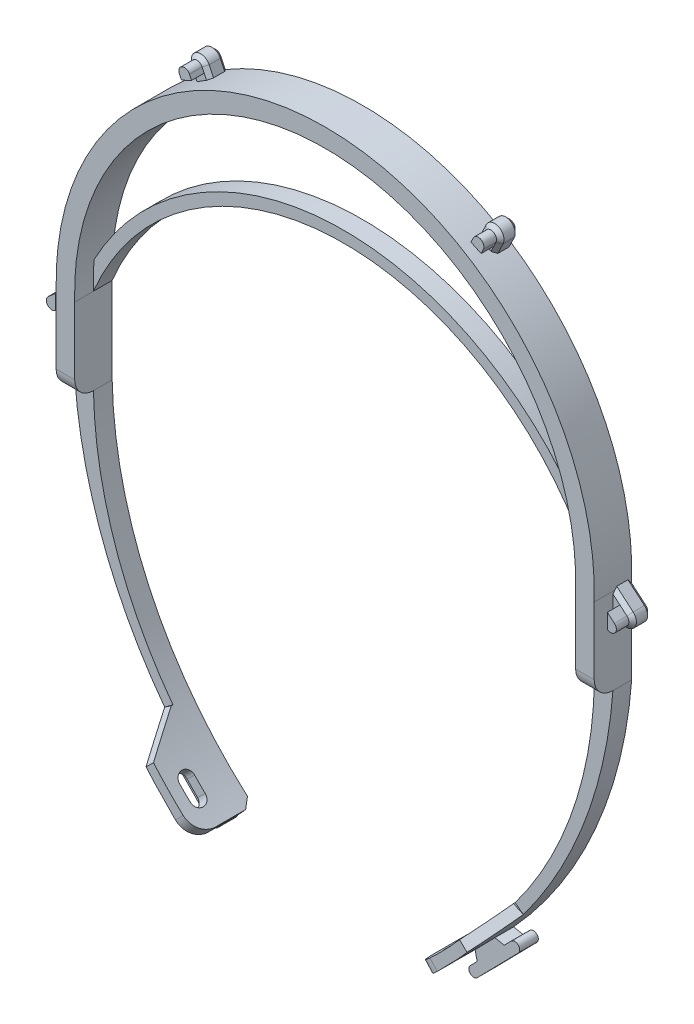
from build123d import *

# Parameters (mm, degrees)
BOSS_EXTRU_1_DEPTH      = 10
BOSS_EXTRU_2_DEPTH      = 5
BOSS_EXTRU_3_DEPTH      = 5
CHANFREIN1_SIZE         = 1
BOSS_EXTRU_4_DEPTH      = 5
BOSS_EXTRU_4_2_DEPTH    = 5
CONG_1_R                = 5
BOSS_EXTRU_5_DEPTH      = 10
ENL_V_MAT_EXTRU_1_DEPTH = 10
ENL_V_MAT_EXTRU_2_DEPTH = 10
CONG_2_R                = 5
CHANFREIN2_SIZE         = 2
CHANFREIN3_SIZE         = 2
CONG_3_R                = 5
ENL_V_MAT_EXTRU_3_DEPTH = 10
ENL_V_MAT_EXTRU_4_DEPTH = 10
BOSS_EXTRU_6_DEPTH      = 3.36


with BuildPart() as part:
    # Model → Boss.-Extru.1 (new body)
    with BuildSketch(Plane.XY):
        with BuildLine():
            Line((-61.373932695, -14.763746224), (-61.38049798, 8.219833358))
            ThreePointArc((-61.38049798, 8.219833358), (-61.393269096, 11.91787934), (-61.2016868, 15.610981479))
            ThreePointArc((-61.2016868, 15.610981479), (5.489429645, 77.202080665), (72.180546089, 15.610981479))
            ThreePointArc((72.180546089, 15.610981479), (72.372128385, 11.91787934), (72.359357269, 8.219833358))
            Line((72.359357269, 8.219833358), (72.36871387, -14.763746224))
            Line((72.36871387, -14.763746224), (77.314432203, -14.763746224))
            Line((77.314432203, -14.763746224), (77.314432203, 8.212108282))
            ThreePointArc((77.314432203, 8.212108282), (5.496951404, 82.135483719), (-66.320525861, 8.212104849))
            Line((-66.320525861, 8.212104849), (-66.320525861, -14.763746224))
            Line((-66.320525861, -14.763746224), (-61.373932695, -14.763746224))
        make_face()
    extrude(amount=BOSS_EXTRU_1_DEPTH)

    # Model<3> → Boss.-Extru.2 (add)
    with BuildSketch(Plane.XY):
        with BuildLine():
            ThreePointArc((-61.2016868, 15.610981479), (-61.393269096, 11.91787934), (-61.38049798, 8.219833358))
            ThreePointArc((-61.38049798, 8.219833358), (5.489429645, 52.748687852), (72.359357269, 8.219833358))
            ThreePointArc((72.359357269, 8.219833358), (72.372128385, 11.91787934), (72.180546089, 15.610981479))
            ThreePointArc((72.180546089, 15.610981479), (5.489429645, 55.748687852), (-61.2016868, 15.610981479))
        make_face()
    extrude(amount=BOSS_EXTRU_2_DEPTH)

    # Esquisse2 → Boss.-Extru.3 (add)
    with BuildSketch(Plane(origin=(0, 0, 0), x_dir=(-1, 0, 0), z_dir=(0, 0, -1))):
        with BuildLine():
            Line((-77.314432203, 8.870984082), (-81.710022703, 5.098794471))
            ThreePointArc((-81.710022703, 5.098794471), (-81.97908689, 1.573519938), (-78.453812317, 1.304456274))
            Line((-78.453812317, 1.304456274), (-75.833363949, 3.553263132))
            Line((-75.833363949, 3.553263132), (-75.833363949, 8.870984082))
            Line((-75.833363949, 8.870984082), (-77.314432203, 8.870984082))
        make_face()
        with BuildLine():
            Line((-45.572582866, 69.906355405), (-46.983871668, 72.863263718))
            ThreePointArc((-46.983871668, 72.863263718), (-45.804527107, 76.196302332), (-42.471488493, 75.016957771))
            Line((-42.471488493, 75.016957771), (-40.737917629, 71.384809562))
            Line((-40.737917629, 71.384809562), (-45.072425044, 68.858433239))
            Line((-45.072425044, 68.858433239), (-45.572582866, 69.906355405))
        make_face()
        with BuildLine():
            Line((34.578685022, 69.90634166), (35.989974627, 72.86325082))
            ThreePointArc((35.989974627, 72.86325082), (34.81063043, 76.196289563), (31.477591687, 75.016945367))
            Line((31.477591687, 75.016945367), (29.954474792, 71.825737636))
            Line((29.954474792, 71.825737636), (34.074200021, 68.849353558))
            Line((34.074200021, 68.849353558), (34.578685022, 69.90634166))
        make_face()
        with BuildLine():
            Line((66.320526921, 8.870983572), (70.716119577, 5.098792808))
            ThreePointArc((70.716119577, 5.098792808), (70.985184768, 1.573515397), (67.459907386, 1.304449818))
            Line((67.459907386, 1.304449818), (65.397783126, 3.07411394))
            Line((65.397783126, 3.07411394), (65.397783126, 9.662859866))
            Line((65.397783126, 9.662859866), (66.320526921, 8.870983572))
        make_face()
    extrude(amount=-BOSS_EXTRU_3_DEPTH)

    # Chanfrein1
    chanfrein1_edges = [part.edges().sort_by_distance(p)[0] for p in [
        (-68.526199198, 6.978129242, 0),
        (-66.890216624, 1.793344363, 0),
        (-70.985184768, 1.573515397, 0),
        (-68.526199198, 6.978129242, 5),
        (-66.890216624, 1.793344363, 5),
        (-70.985184768, 1.573515397, 5),
        (77.88412226, 1.793350817, 5),
        (81.97908689, 1.573519938, 5),
        (79.520103879, 6.978129918, 5),
        (77.88412226, 1.793350817, 0),
        (81.97908689, 1.573519938, 0),
        (79.520103879, 6.978129918, 0),
        (46.280736809, 71.390067512, 0),
        (45.804527107, 76.196302332, 0),
        (41.888889757, 73.796306803, 0),
        (46.280736809, 71.390067512, 5),
        (41.888889757, 73.796306803, 5),
        (45.804527107, 76.196302332, 5),
        (-30.894994129, 73.796297211, 0),
        (-34.81063043, 76.196289563, 0),
        (-35.286840831, 71.390057256, 0),
        (-30.894994129, 73.796297211, 5),
        (-34.81063043, 76.196289563, 5),
        (-35.286840831, 71.390057256, 5),
    ]]
    chamfer(chanfrein1_edges, length=CHANFREIN1_SIZE)

    # Congé1
    cong_1_edges = [part.edges().sort_by_distance(p)[0] for p in [
        (74.841573037, -14.763746224, 10),
        (-63.847229278, -14.763746224, 10),
    ]]
    fillet(cong_1_edges, radius=CONG_1_R)

    # Esquisse9 → Boss.-Extru.6 (add)
    with BuildSketch(Plane.XY.offset(5)):
        with BuildLine():
            Line((-68.120525861, 6.008518066), (-70.064876489, 4.339923622))
            ThreePointArc((-70.064876489, 4.339923622), (-70.230314776, 2.229437991), (-68.120525861, 2.055339854))
            Line((-68.120525861, 2.055339854), (-68.120525861, 6.008518066))
        make_face()
        with BuildLine():
            Line((81.058779546, 4.339925345), (79.184432203, 5.948444968))
            Line((79.184432203, 5.948444968), (79.184432203, 1.999749146))
            ThreePointArc((79.184432203, 1.999749146), (81.252678786, 2.263912509), (81.058779546, 4.339925345))
        make_face()
        with BuildLine():
            Line((45.478360698, 72.030535239), (46.081395033, 73.294002529))
            ThreePointArc((46.081395033, 73.294002529), (45.373788296, 75.293825697), (43.373965128, 74.586218961))
            Line((43.373965128, 74.586218961), (42.770930793, 73.322751671))
            Line((42.770930793, 73.322751671), (45.478360698, 72.030535239))
        make_face()
        with BuildLine():
            Line((-31.820107692, 73.412986893), (-32.380068275, 74.586206458))
            ThreePointArc((-32.380068275, 74.586206458), (-34.379891521, 75.293812975), (-35.087498039, 73.293989729))
            Line((-35.087498039, 73.293989729), (-34.527537456, 72.120770165))
            Line((-34.527537456, 72.120770165), (-31.820107692, 73.412986893))
        make_face()
    extrude(amount=BOSS_EXTRU_6_DEPTH)


with BuildPart() as body_2:
    # Esquisse3 → Boss.-Extru.4 (new body)
    with BuildSketch(Plane(origin=(0, 0, 0), x_dir=(-1, 0, 0), z_dir=(0, 0, -1))):
        with BuildLine():
            Line((-72.36871387, -14.763746224), (-77.314432203, -14.763746224))
            ThreePointArc((-77.314432203, -14.763746224), (-67.707413402, -53.872172258), (-45.790618412, -87.657048972))
            Line((-45.790618412, -87.657048972), (-48.290206469, -88.152279094))
            Line((-48.290206469, -88.152279094), (-50.140114394, -86.268846896))
            ThreePointArc((-50.140114394, -86.268846896), (-52.006822423, -86.252083774), (-52.023586833, -88.118791792))
            Line((-52.023586833, -88.118791792), (-41.08927726, -99.251017783))
            ThreePointArc((-41.08927726, -99.251017783), (-39.222595288, -99.26775831), (-39.205858527, -97.401076304))
            Line((-39.205858527, -97.401076304), (-41.055766451, -95.517644106))
            Line((-41.055766451, -95.517644106), (-40.520549136, -93.049197796))
            ThreePointArc((-40.520549136, -93.049197796), (-38.650944533, -94.808635343), (-36.744408844, -96.527985082))
            Line((-36.744408844, -96.527985082), (-34.726643799, -94.307938085))
            ThreePointArc((-34.726643799, -94.307938085), (-62.188157188, -58.624707526), (-72.36871387, -14.763746224))
        make_face()
    extrude(amount=-BOSS_EXTRU_4_DEPTH)



with BuildPart() as body_3:
    # Esquisse3 → Boss.-Extru.4 2 (new body)
    with BuildSketch(Plane(origin=(0, 0, 0), x_dir=(-1, 0, 0), z_dir=(0, 0, -1))):
        with BuildLine():
            ThreePointArc((61.373932695, -14.763746224), (51.103976482, -58.578565782), (23.737420886, -94.303655682))
            Line((23.737420886, -94.303655682), (25.750502502, -96.527985082))
            ThreePointArc((25.750502502, -96.527985082), (27.653147132, -94.797732953), (29.518958509, -93.02782422))
            Line((29.518958509, -93.02782422), (30.060707706, -95.512739101))
            Line((30.060707706, -95.512739101), (28.212944034, -97.39827499))
            ThreePointArc((28.212944034, -97.39827499), (28.231818324, -99.264922923), (30.098466495, -99.246072231))
            Line((30.098466495, -99.246072231), (41.020102237, -88.101411892))
            ThreePointArc((41.020102237, -88.101411892), (41.001224903, -86.23471284), (39.134526065, -86.253611294))
            Line((39.134526065, -86.253611294), (37.286762393, -88.139147182))
            Line((37.286762393, -88.139147182), (34.749323004, -87.639417649))
            ThreePointArc((34.749323004, -87.639417649), (56.620539625, -53.837992525), (66.320525861, -14.763746224))
            Line((66.320525861, -14.763746224), (61.373932695, -14.763746224))
        make_face()
    extrude(amount=-BOSS_EXTRU_4_2_DEPTH)


with BuildPart() as body_2_1:
    add(body_2.part)

    add(body_3.part)  # Boss.-Extru.5 merges body 3
    # Esquisse4 → Boss.-Extru.5 (add)
    with BuildSketch(Plane.XY.offset(5)):
        with BuildLine():
            Line((-34.749323004, -87.639417649), (-29.518958509, -93.02782422))
            ThreePointArc((-29.518958509, -93.02782422), (-27.653147132, -94.797732953), (-25.750502502, -96.527985082))
            Line((-25.750502502, -96.527985082), (-23.737420886, -94.303655682))
            ThreePointArc((-23.737420886, -94.303655682), (-32.436383569, -86.010099926), (-40.151077353, -76.793890367))
            Line((-40.151077353, -76.793890367), (-42.356972057, -78.438989989))
            ThreePointArc((-42.356972057, -78.438989989), (-38.665570012, -83.132163714), (-34.749323004, -87.639417649))
        make_face()
        with BuildLine():
            Line((51.198851815, -76.853243499), (53.398267645, -78.505595215))
            ThreePointArc((53.398267645, -78.505595215), (49.707091826, -83.174967601), (45.790618412, -87.657048972))
            Line((45.790618412, -87.657048972), (40.520549136, -93.049197796))
            ThreePointArc((40.520549136, -93.049197796), (38.650944533, -94.808635343), (36.744408844, -96.527985082))
            Line((36.744408844, -96.527985082), (34.726643799, -94.307938085))
            ThreePointArc((34.726643799, -94.307938085), (43.45812135, -86.048080842), (51.198851815, -76.853243499))
        make_face()
    extrude(amount=BOSS_EXTRU_5_DEPTH)

    # Esquisse5 → Enlèv. mat.-Extru.1 (cut)
    with BuildSketch(Plane(origin=(67.23656529, -65.714313281, 0), x_dir=(0, 0, -1), z_dir=(0.7151560891071918, -0.6989647832422651, 0))):
        Polygon((-15, -26.820245877), (-5, -18.820245877), (-15, -18.820245877), align=None)
    extrude(amount=-ENL_V_MAT_EXTRU_1_DEPTH, mode=Mode.SUBTRACT)

    # Esquisse6 → Enlèv. mat.-Extru.2 (cut)
    with BuildSketch(Plane(origin=(67.23656529, -65.714313281, 0), x_dir=(0, 0, -1), z_dir=(0.7151560891071918, -0.6989647832422651, 0))):
        with BuildLine():
            Line((-12, -36.682442653), (-12, -32.682442653))
            ThreePointArc((-12, -32.682442653), (-10, -30.682442653), (-8, -32.682442653))
            Line((-8, -32.682442653), (-8, -36.682442653))
            ThreePointArc((-8, -36.682442653), (-10, -38.682442653), (-12, -36.682442653))
        make_face()
    extrude(amount=-ENL_V_MAT_EXTRU_2_DEPTH, mode=Mode.SUBTRACT)

    # Congé2
    cong_2_edges = [body_2_1.edges().sort_by_distance(p)[0] for p in [
        (35.735526322, -95.417961583, 15),
    ]]
    fillet(cong_2_edges, radius=CONG_2_R)

    # Chanfrein2
    chanfrein2_edges = [body_2_1.edges().sort_by_distance(p)[0] for p in [
        (35.735526322, -95.417961583, 0),
    ]]
    chamfer(chanfrein2_edges, length=CHANFREIN2_SIZE)

    # Chanfrein3
    chanfrein3_edges = [body_2_1.edges().sort_by_distance(p)[0] for p in [
        (-24.743961694, -95.415820382, 0),
    ]]
    chamfer(chanfrein3_edges, length=CHANFREIN3_SIZE)

    # Congé3
    cong_3_edges = [body_2_1.edges().sort_by_distance(p)[0] for p in [
        (-24.743961694, -95.415820382, 15),
    ]]
    fillet(cong_3_edges, radius=CONG_3_R)

    # Esquisse7 → Enlèv. mat.-Extru.3 (cut)
    with BuildSketch(Plane(origin=(-61.692030606, -59.882602071, 0), x_dir=(0, 0, 1), z_dir=(-0.7175513762947772, -0.696505579573826, 0))):
        Polygon((5, -26.782137851), (15, -34.782137851), (15, -26.782137851), align=None)
    extrude(amount=-ENL_V_MAT_EXTRU_3_DEPTH, mode=Mode.SUBTRACT)

    # Esquisse8 → Enlèv. mat.-Extru.4 (cut)
    with BuildSketch(Plane(origin=(-61.692030606, -59.882602071, 0), x_dir=(0, 0, 1), z_dir=(-0.7175513762947772, -0.696505579573826, 0))):
        with BuildLine():
            Line((12, -40.682687394), (12, -44.682687394))
            ThreePointArc((12, -44.682687394), (10, -46.682687394), (8, -44.682687394))
            Line((8, -44.682687394), (8, -40.682687394))
            ThreePointArc((8, -40.682687394), (10, -38.682687394), (12, -40.682687394))
        make_face()
    extrude(amount=-ENL_V_MAT_EXTRU_4_DEPTH, mode=Mode.SUBTRACT)


solid = Compound([part.part, body_2_1.part])
